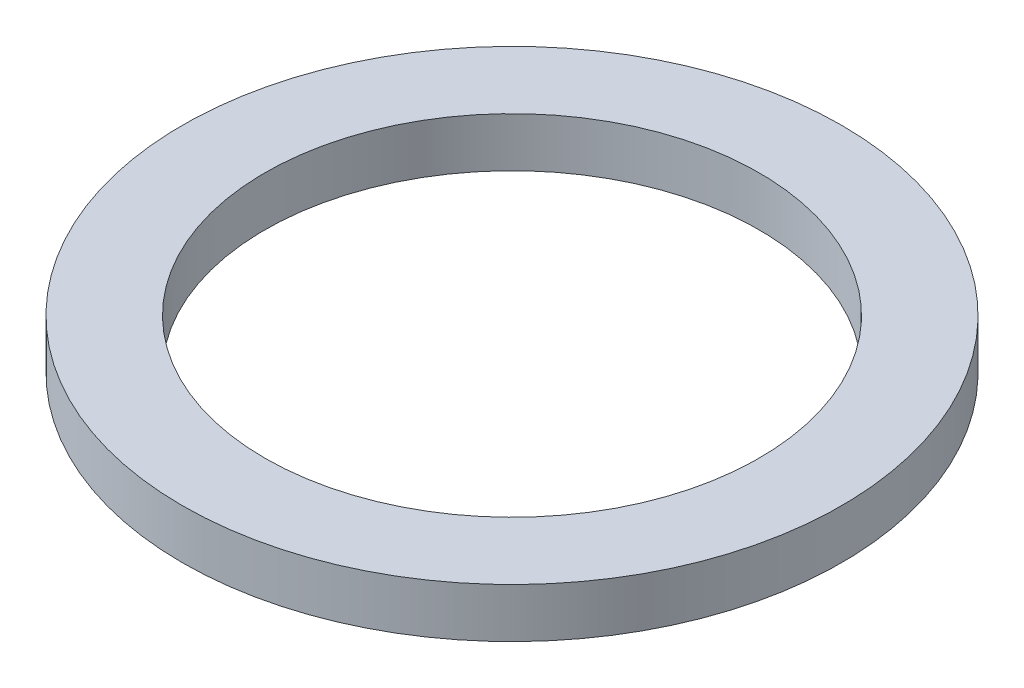
from build123d import *

# Parameters (mm, degrees)
SKETCH1_R           = 10
SKETCH1_R_2         = 7.5
BOSS_EXTRUDE1_DEPTH = 1.5


with BuildPart() as part:
    # Sketch1 → Boss-Extrude1 (new body)
    with BuildSketch(Plane(origin=(0, 0, 0), x_dir=(1, 0, 0), z_dir=(0, 1, 0))):
        with Locations(Location((0, 0, 0), (0, 0, 270))):
            Circle(SKETCH1_R)
        with Locations(Location((0, 0, 0), (0, 0, 270))):
            Circle(SKETCH1_R_2, mode=Mode.SUBTRACT)
    extrude(amount=BOSS_EXTRUDE1_DEPTH)


solid = part.part
